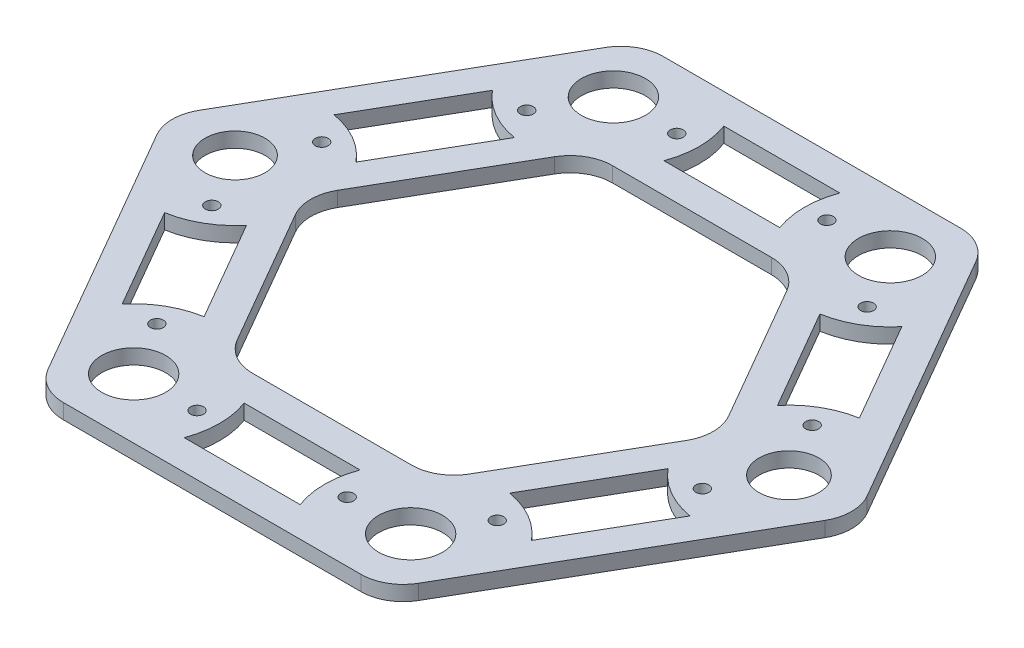
from build123d import *

# Parameters (mm, degrees)
SKETCH1_R           = 13.545312508
SKETCH1_R_2         = 12.7
SKETCH1_R_3         = 2.749999961
BOSS_EXTRUDE1_DEPTH = 6.35


with BuildPart() as part:
    # Sketch1 → Boss-Extrude1 (new body)
    with BuildSketch(Plane(origin=(0, 0, 0), x_dir=(1, 0, 0), z_dir=(0, 1, 0))):
        with BuildLine():
            Line((141.475775265, 8.956769201), (78.494677297, 118.043230799))
            ThreePointArc((78.494677297, 118.043230799), (71.937867169, 124.600040926), (62.981097968, 127))
            Line((62.981097968, 127), (-62.981097968, 127))
            ThreePointArc((-62.981097968, 127), (-71.937867169, 124.600040926), (-78.494677297, 118.043230799))
            Line((-78.494677297, 118.043230799), (-141.475775265, 8.956769201))
            ThreePointArc((-141.475775265, 8.956769201), (-143.875734339, 0), (-141.475775265, -8.956769201))
            Line((-141.475775265, -8.956769201), (-78.494677297, -118.043230799))
            ThreePointArc((-78.494677297, -118.043230799), (-71.937867169, -124.600040926), (-62.981097968, -127))
            Line((-62.981097968, -127), (62.981097968, -127))
            ThreePointArc((62.981097968, -127), (71.937867169, -124.600040926), (78.494677297, -118.043230799))
            Line((78.494677297, -118.043230799), (141.475775265, -8.956769201))
            ThreePointArc((141.475775265, -8.956769201), (143.875734339, 0), (141.475775265, 8.956769201))
        make_face()
        with Locations(Location((-58.65878735, 101.6, 0), (0, 0, 270))):
            Circle(SKETCH1_R, mode=Mode.SUBTRACT)
        with Locations(Location((-58.65878735, -101.6, 0), (0, 0, 270))):
            Circle(SKETCH1_R, mode=Mode.SUBTRACT)
        with Locations(Location((58.65878735, -101.6, 0), (0, 0, 270))):
            Circle(SKETCH1_R, mode=Mode.SUBTRACT)
        with Locations(Location((58.65878735, 101.6, 0), (0, 0, 270))):
            Circle(SKETCH1_R, mode=Mode.SUBTRACT)
        with Locations(Location((-117.317574699, 0, 0), (0, 0, 270))):
            Circle(SKETCH1_R_2, mode=Mode.SUBTRACT)
        with Locations(Location((117.317574699, 0, 0), (0, 0, 270))):
            Circle(SKETCH1_R_2, mode=Mode.SUBTRACT)
        with Locations(Location((-72.091982251, 78.333023923, 0), (0, 0, 270))):
            Circle(SKETCH1_R_3, mode=Mode.SUBTRACT)
        with Locations(Location((-31.792397547, 101.6, 0), (0, 0, 270))):
            Circle(SKETCH1_R_3, mode=Mode.SUBTRACT)
        with Locations(Location((31.792397547, 101.6, 0), (0, 0, 270))):
            Circle(SKETCH1_R_3, mode=Mode.SUBTRACT)
        with Locations(Location((72.091982251, 78.333023923, 0), (0, 0, 270))):
            Circle(SKETCH1_R_3, mode=Mode.SUBTRACT)
        with Locations(Location((-103.884379798, 23.266976077, 0), (0, 0, 270))):
            Circle(SKETCH1_R_3, mode=Mode.SUBTRACT)
        with Locations(Location((-103.884379798, -23.266976077, 0), (0, 0, 270))):
            Circle(SKETCH1_R_3, mode=Mode.SUBTRACT)
        with Locations(Location((-31.792397547, -101.6, 0), (0, 0, 270))):
            Circle(SKETCH1_R_3, mode=Mode.SUBTRACT)
        with Locations(Location((-72.091982251, -78.333023923, 0), (0, 0, 270))):
            Circle(SKETCH1_R_3, mode=Mode.SUBTRACT)
        with Locations(Location((103.884379798, -23.266976077, 0), (0, 0, 270))):
            Circle(SKETCH1_R_3, mode=Mode.SUBTRACT)
        with Locations(Location((103.884379798, 23.266976077, 0), (0, 0, 270))):
            Circle(SKETCH1_R_3, mode=Mode.SUBTRACT)
        with Locations(Location((72.091982251, -78.333023923, 0), (0, 0, 270))):
            Circle(SKETCH1_R_3, mode=Mode.SUBTRACT)
        with Locations(Location((31.792397547, -101.6, 0), (0, 0, 270))):
            Circle(SKETCH1_R_3, mode=Mode.SUBTRACT)
        with BuildLine():
            Line((82.816987915, 8.956769201), (49.165283622, 67.243230799))
            ThreePointArc((49.165283622, 67.243230799), (42.608473495, 73.800040926), (33.651704293, 76.2))
            Line((33.651704293, 76.2), (-33.651704293, 76.2))
            ThreePointArc((-33.651704293, 76.2), (-42.608473495, 73.800040926), (-49.165283622, 67.243230799))
            Line((-49.165283622, 67.243230799), (-82.816987915, 8.956769201))
            ThreePointArc((-82.816987915, 8.956769201), (-85.216946989, 0), (-82.816987915, -8.956769201))
            Line((-82.816987915, -8.956769201), (-49.165283622, -67.243230799))
            ThreePointArc((-49.165283622, -67.243230799), (-42.608473495, -73.800040926), (-33.651704293, -76.2))
            Line((-33.651704293, -76.2), (33.651704293, -76.2))
            ThreePointArc((33.651704293, -76.2), (42.608473495, -73.800040926), (49.165283622, -67.243230799))
            Line((49.165283622, -67.243230799), (82.816987915, -8.956769201))
            ThreePointArc((82.816987915, -8.956769201), (85.216946989, 0), (82.816987915, 8.956769201))
        make_face(mode=Mode.SUBTRACT)
        with BuildLine():
            Line((-24.555367407, 114.3), (24.555367407, 114.3))
            ThreePointArc((24.555367407, 114.3), (22.267397547, 101.6), (24.555367407, 88.9))
            Line((24.555367407, 88.9), (-24.555367407, 88.9))
            ThreePointArc((-24.555367407, 88.9), (-22.267397547, 101.6), (-24.555367407, 114.3))
        make_face(mode=Mode.SUBTRACT)
        with BuildLine():
            Line((-86.709019949, 78.415571974), (-111.264387356, 35.884428026))
            ThreePointArc((-111.264387356, 35.884428026), (-99.121879798, 31.515868048), (-89.2673421, 23.184428026))
            Line((-89.2673421, 23.184428026), (-64.711974693, 65.715571974))
            ThreePointArc((-64.711974693, 65.715571974), (-76.854482251, 70.084131952), (-86.709019949, 78.415571974))
        make_face(mode=Mode.SUBTRACT)
        with BuildLine():
            Line((-89.2673421, -23.184428026), (-64.711974693, -65.715571974))
            ThreePointArc((-64.711974693, -65.715571974), (-76.854482251, -70.084131952), (-86.709019949, -78.415571974))
            Line((-86.709019949, -78.415571974), (-111.264387356, -35.884428026))
            ThreePointArc((-111.264387356, -35.884428026), (-99.121879798, -31.515868048), (-89.2673421, -23.184428026))
        make_face(mode=Mode.SUBTRACT)
        with BuildLine():
            Line((-24.555367407, -88.9), (24.555367407, -88.9))
            ThreePointArc((24.555367407, -88.9), (22.267397547, -101.6), (24.555367407, -114.3))
            Line((24.555367407, -114.3), (-24.555367407, -114.3))
            ThreePointArc((-24.555367407, -114.3), (-22.267397547, -101.6), (-24.555367407, -88.9))
        make_face(mode=Mode.SUBTRACT)
        with BuildLine():
            Line((89.2673421, -23.184428026), (64.711974693, -65.715571974))
            ThreePointArc((64.711974693, -65.715571974), (76.854482251, -70.084131952), (86.709019949, -78.415571974))
            Line((86.709019949, -78.415571974), (111.264387356, -35.884428026))
            ThreePointArc((111.264387356, -35.884428026), (99.121879798, -31.515868048), (89.2673421, -23.184428026))
        make_face(mode=Mode.SUBTRACT)
        with BuildLine():
            Line((64.711974693, 65.715571974), (89.2673421, 23.184428026))
            ThreePointArc((89.2673421, 23.184428026), (99.121879798, 31.515868048), (111.264387356, 35.884428026))
            Line((111.264387356, 35.884428026), (86.709019949, 78.415571974))
            ThreePointArc((86.709019949, 78.415571974), (76.854482251, 70.084131952), (64.711974693, 65.715571974))
        make_face(mode=Mode.SUBTRACT)
    extrude(amount=BOSS_EXTRUDE1_DEPTH)


solid = part.part
